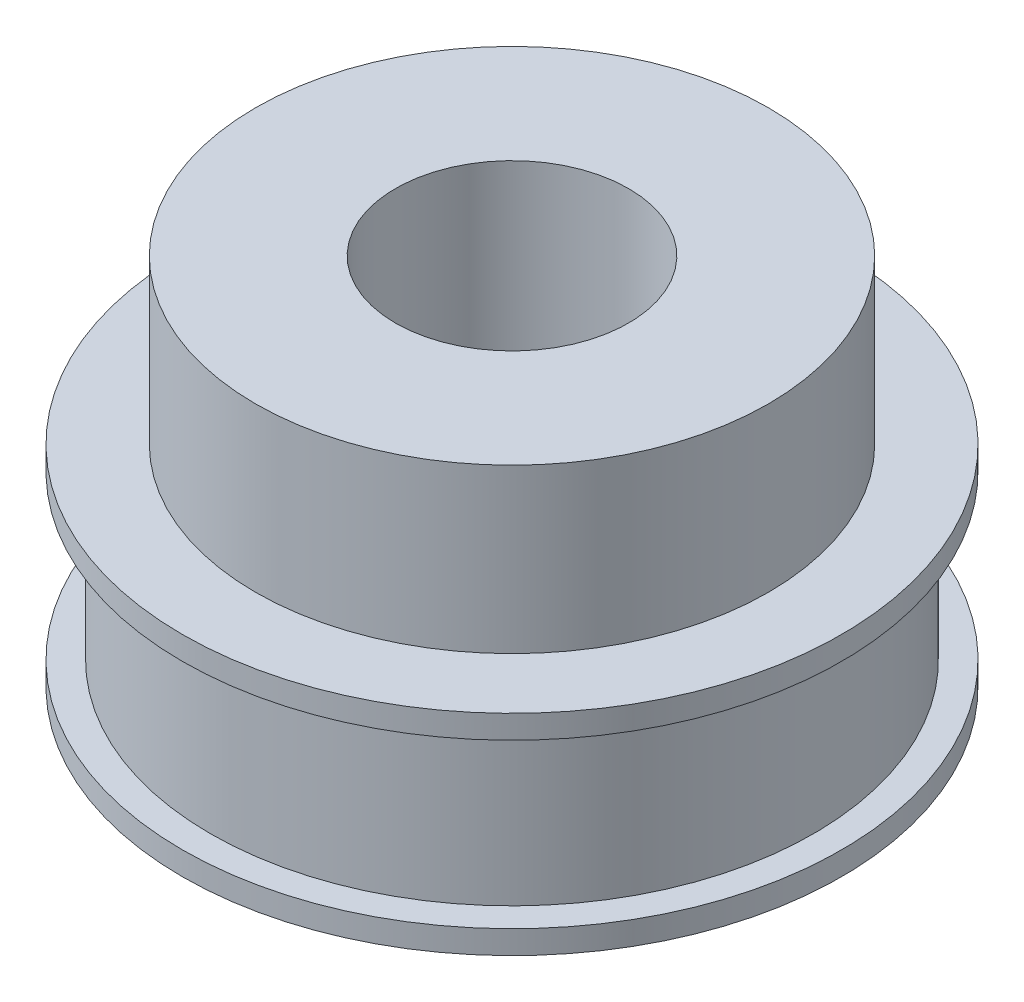
from build123d import *

# Parameters (mm, degrees)
SKETCH_1_R          = 12.935
EXTRUDE_1_DEPTH     = 7
SKETCH_2_R          = 14.135
EXTRUDE_2_DEPTH     = 1
SKETCH_3_R          = 11
EXTRUDE_3_DEPTH     = 7
SKETCH_4_R          = 5
CUT_EXTRUDE_1_DEPTH = 26.604617748


with BuildPart() as part:
    # 草图1 → 凸台-拉伸1 (new body)
    with BuildSketch(Plane(origin=(0, 0, 0), x_dir=(1, 0, 0), z_dir=(0, 1, 0))):
        with Locations(Location((0, 0, 0), (0, 0, 270))):
            Circle(SKETCH_1_R)
    extrude(amount=EXTRUDE_1_DEPTH)

    # 草图2 → 凸台-拉伸2 (add)
    with BuildSketch(Plane(origin=(0, 7, 0), x_dir=(1, 0, 0), z_dir=(0, 1, 0))):
        with Locations(Location((0, 0, 0), (0, 0, 270))):
            Circle(SKETCH_2_R)
    extrude_2 = extrude(amount=EXTRUDE_2_DEPTH)

    # 镜向1: 凸台-拉伸2 across plane
    add(extrude_2.mirror(Plane.ZX.offset(3.5)))

    # 草图3 → 凸台-拉伸3 (add)
    with BuildSketch(Plane(origin=(0, 8, 0), x_dir=(1, 0, 0), z_dir=(0, 1, 0))):
        with Locations(Location((0, 0, 0), (0, 0, 90))):
            Circle(SKETCH_3_R)
    extrude(amount=EXTRUDE_3_DEPTH)

    # 草图4 → 切除-拉伸1 (cut, through all)
    with BuildSketch(Plane(origin=(0, 15, 0), x_dir=(1, 0, 0), z_dir=(0, 1, 0))):
        with Locations(Location((0, 0, 0), (0, 0, 270))):
            Circle(SKETCH_4_R)
    extrude(amount=-CUT_EXTRUDE_1_DEPTH, mode=Mode.SUBTRACT)


solid = part.part
